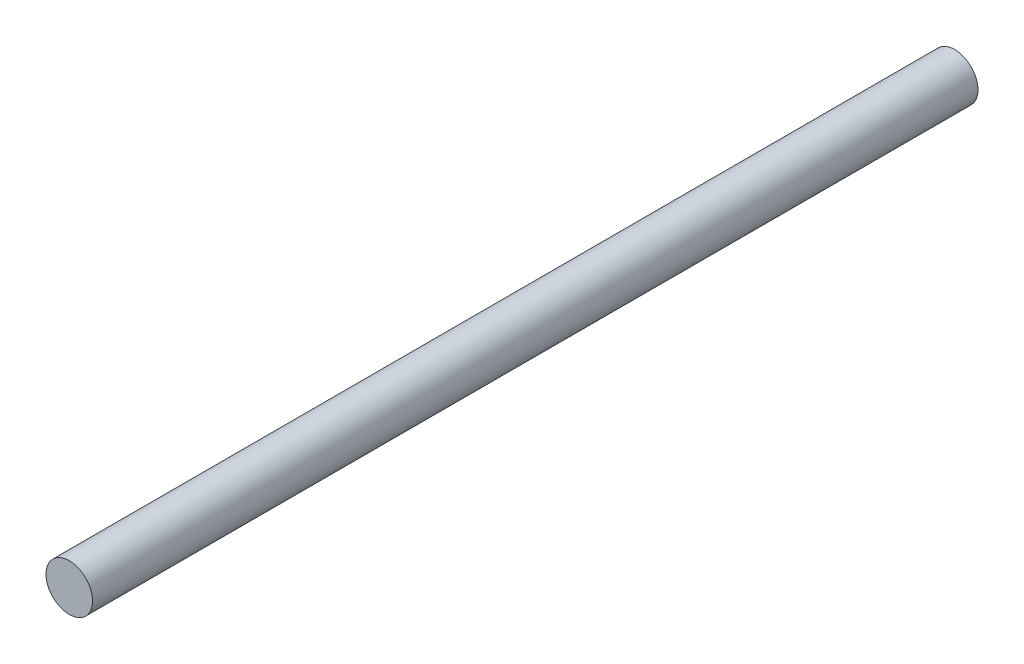
from build123d import *

# Parameters (mm, degrees)
SKETCH1_R           = 2
BOSS_EXTRUDE1_DEPTH = 76


with BuildPart() as part:
    # Sketch1 → Boss-Extrude1 (new body)
    with BuildSketch(Plane.XY):
        Circle(SKETCH1_R)
    extrude(amount=BOSS_EXTRUDE1_DEPTH)


solid = part.part
